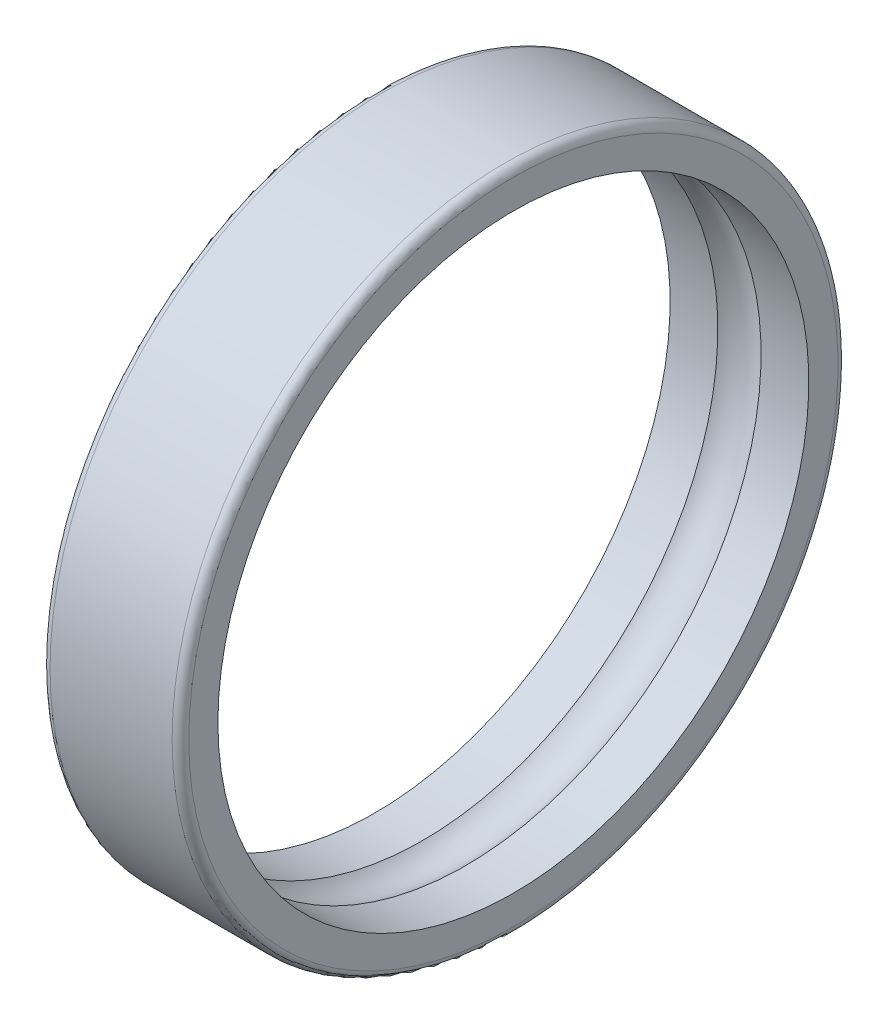
from build123d import *


with BuildPart() as part:
    # Sketch1 → Revolução1 (revolve)
    with BuildSketch(Plane.XY, mode=Mode.PRIVATE) as revolu_o1_sk:
        with BuildLine():
            Line((0, 11.7), (0, 10.65))
            Line((0, 10.65), (1.720711703, 10.65))
            ThreePointArc((1.720711703, 10.65), (2.5, 10.9405), (3.279288297, 10.65))
            Line((3.279288297, 10.65), (5, 10.65))
            Line((5, 10.65), (5, 11.7))
            ThreePointArc((5, 11.7), (4.912132034, 11.912132034), (4.7, 12))
            Line((4.7, 12), (0.3, 12))
            ThreePointArc((0.3, 12), (0.087867966, 11.912132034), (0, 11.7))
        make_face()
    revolve(revolu_o1_sk.sketch.rotate(Axis((200, 0, 0), (-1, 0, 0)), 270), axis=Axis((200, 0, 0), (-1, 0, 0)))


solid = part.part
